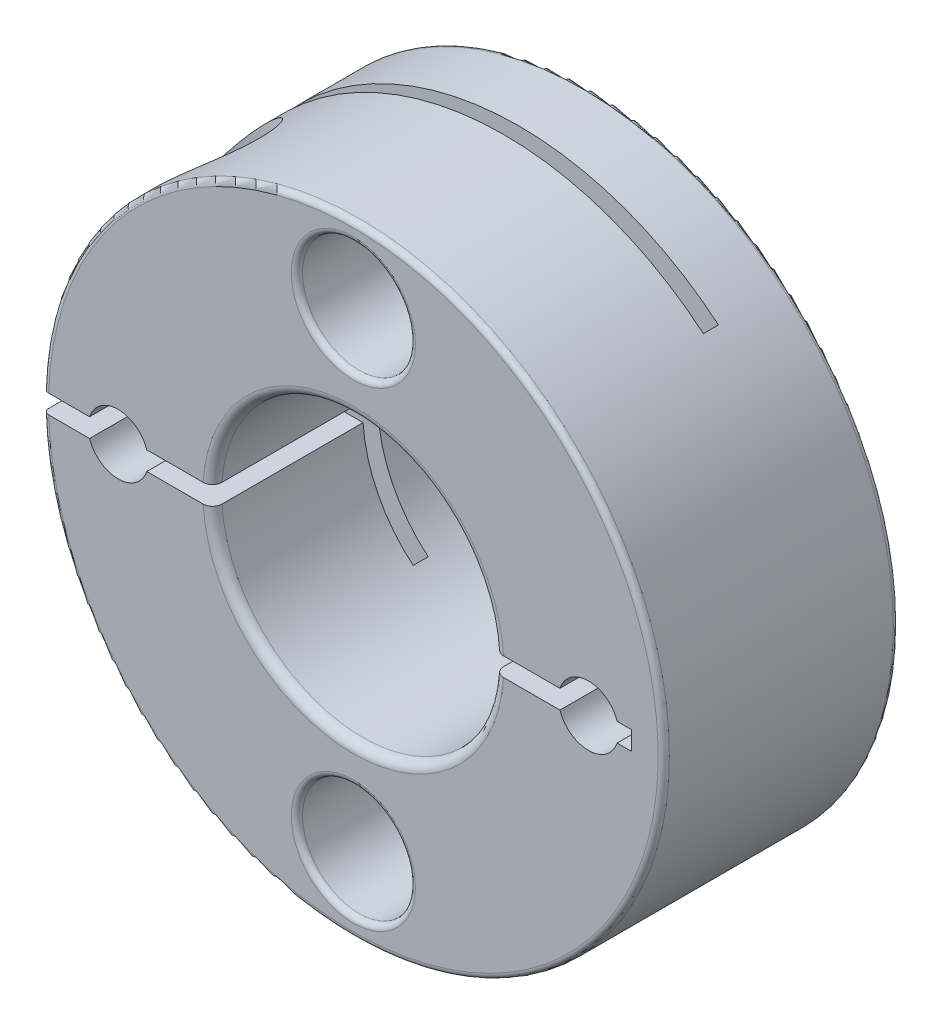
from build123d import *

# Parameters (mm, degrees)
SKETCH1_R           = 16.5
BOSS_EXTRUDE1_DEPTH = 12.5
CUT_EXTRUDE21_DEPTH = 0.8
SKETCH4_R           = 7.5
CUT_EXTRUDE2_DEPTH  = 27.471682984
FILLET3_R           = 0.5
CUT_EXTRUDE11_DEPTH = 0.5
SKETCH5_R           = 3
CUT_EXTRUDE4_DEPTH  = 27.471683031
TAP1_D              = 2.459
TAP1_DEPTH          = 4
TAP1_TIP            = 0.738758131
SKETCH9_R           = 3
CUT_EXTRUDE6_DEPTH  = 30.133314307
SKETCH11_R          = 1.6
CUT_EXTRUDE7_DEPTH  = 4.5
TAP2_D              = 2.459
FILLET1_R           = 0.3
FILLET2_R           = 0.3
FILLET4_R           = 0.1
SKETCH16_R          = 1.6
CUT_EXTRUDE24_DEPTH = 25.834452043


with BuildPart() as part:
    # Sketch1 → Boss-Extrude1 (new body)
    with BuildSketch(Plane.XY):
        Circle(SKETCH1_R)
    extrude(amount=BOSS_EXTRUDE1_DEPTH)

    # Sketch2 → Cut-Extrude21 (cut)
    with BuildSketch(Plane(origin=(0, 0, 3.7), x_dir=(-1, 0, 0), z_dir=(0, 0, -1))):
        with BuildLine():
            Line((-10.60599556, 12.639733311), (10.60599556, -12.639733311))
            ThreePointArc((10.60599556, -12.639733311), (12.639733311, 10.60599556), (-10.60599556, 12.639733311))
        make_face()
    extrude(amount=-CUT_EXTRUDE21_DEPTH, mode=Mode.SUBTRACT)

    # Sketch4 → Cut-Extrude2 (cut, through all)
    with BuildSketch(Plane.XY.offset(12.5)):
        Circle(SKETCH4_R)
    extrude(amount=-CUT_EXTRUDE2_DEPTH, mode=Mode.SUBTRACT)

    # Fillet3
    fillet3_edges = [part.edges().sort_by_distance(p)[0] for p in [
        (-7.5, 0, 0),
        (-7.5, 0, 12.5),
    ]]
    fillet(fillet3_edges, radius=FILLET3_R)

    # Sketch3 → Cut-Extrude11 (cut, symmetric)
    with BuildSketch(Plane(origin=(0, 0, 0), x_dir=(1, 0, 0), z_dir=(0, 1, 0))):
        with BuildLine():
            Line((0, -4.5), (-16.5, -4.5))
            Line((-16.5, -4.5), (-16.5, -12.5))
            Line((-16.5, -12.5), (14.781858905, -12.5))
            ThreePointArc((14.781858905, -12.5), (8.198241617, -7.613289249), (0, -7.500183374))
            Line((0, -7.500183374), (0, -4.5))
        make_face()
    extrude(amount=CUT_EXTRUDE11_DEPTH, both=True, mode=Mode.SUBTRACT)

    # Sketch5 → Cut-Extrude4 (cut, through all)
    with BuildSketch(Plane(origin=(0, 0, 0), x_dir=(-1, 0, 0), z_dir=(0, 0, -1))):
        with Locations((0, 12.5)):
            Circle(SKETCH5_R)
        with Locations((0, -12.5)):
            Circle(SKETCH5_R)
    extrude(amount=-CUT_EXTRUDE4_DEPTH, mode=Mode.SUBTRACT)

    # Tap1
    with Locations(Plane(origin=(0, 0, 0), x_dir=(-1, 0, 0), z_dir=(0, 0, -1))):
        with Locations((-12.5, 0), (12.5, 0)):
            Hole(TAP1_D / 2, depth=TAP1_DEPTH)
            with Locations((0, 0, -(TAP1_DEPTH + TAP1_TIP / 2))):  # 118° drill point
                Cone(0, TAP1_D / 2, TAP1_TIP, mode=Mode.SUBTRACT)

    # Sketch9 → Cut-Extrude6 (cut, through all)
    with BuildSketch(Plane(origin=(0, 4, 0), x_dir=(1, 0, 0), z_dir=(0, 1, 0))):
        with Locations((-12, -8.5)):
            Circle(SKETCH9_R)
    extrude(amount=CUT_EXTRUDE6_DEPTH, mode=Mode.SUBTRACT)

    # Sketch11 → Cut-Extrude7 (cut)
    with BuildSketch(Plane(origin=(0, 4, 0), x_dir=(1, 0, 0), z_dir=(0, 1, 0))):
        with Locations((-12, -8.5)):
            Circle(SKETCH11_R)
    extrude(amount=-CUT_EXTRUDE7_DEPTH, mode=Mode.SUBTRACT)

    # Tap2 (through all)
    with Locations(Plane(origin=(0, 0, 0), x_dir=(1, 0, 0), z_dir=(0, 1, 0))):
        with Locations((-12, -8.5)):
            Hole(TAP2_D / 2)

    # Fillet1
    fillet1_edges = [part.edges().sort_by_distance(p)[0] for p in [
        (3, -12.5, 12.5),
        (3, 12.5, 12.5),
    ]]
    fillet(fillet1_edges, radius=FILLET1_R)

    # Fillet2
    fillet2_edges = [part.edges().sort_by_distance(p)[0] for p in [
        (-16.5, 0, 0),
        (0.250028708, 16.498105517, 12.5),
    ]]
    fillet(fillet2_edges, radius=FILLET2_R)

    # Fillet4
    fillet4_edges = [part.edges().sort_by_distance(p)[0] for p in [
        (-13.6, 4, 8.5),
    ]]
    fillet(fillet4_edges, radius=FILLET4_R)

    # Sketch16 → Cut-Extrude24 (cut, through all)
    with BuildSketch(Plane(origin=(0, 0, 4), x_dir=(-1, 0, 0), z_dir=(0, 0, -1))):
        with Locations((12.5, 0)):
            Circle(SKETCH16_R)
        with Locations((-12.5, 0)):
            Circle(SKETCH16_R)
    extrude(amount=-CUT_EXTRUDE24_DEPTH, mode=Mode.SUBTRACT)


solid = part.part
